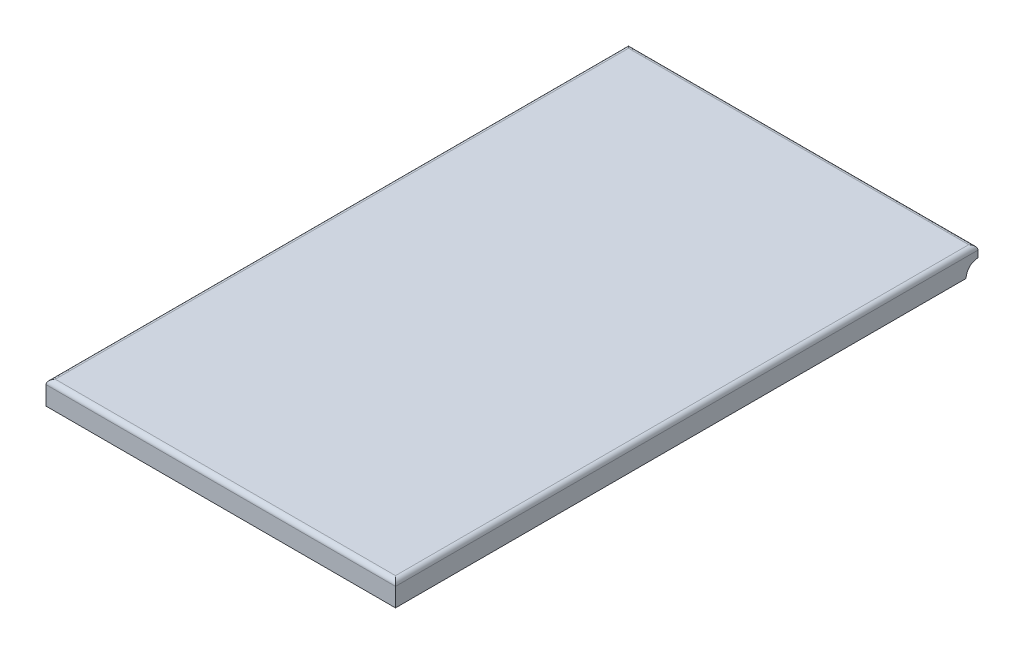
from build123d import *

# Parameters (mm, degrees)
SKETCH1_W           = 150
SKETCH1_H           = 10
BOSS_EXTRUDE1_DEPTH = 250
FILLET1_R           = 2
SKETCH2_R           = 5.1
CUT_EXTRUDE1_DEPTH  = 30.1
SKETCH3_R           = 5
BOSS_EXTRUDE2_DEPTH = 29.85
SKETCH4_R           = 5.1
CUT_EXTRUDE2_DEPTH  = 30.1
SKETCH5_R           = 5
BOSS_EXTRUDE3_DEPTH = 29.85
SKETCH6_R           = 5.1
CUT_EXTRUDE3_DEPTH  = 30.1
SKETCH7_R           = 0.875
CUT_EXTRUDE4_DEPTH  = 90.1


with BuildPart() as part:
    # Sketch1 → Boss-Extrude1 (new body)
    with BuildSketch(Plane.XY):
        with Locations((75, 5)):
            Rectangle(SKETCH1_W, SKETCH1_H)
    extrude(amount=BOSS_EXTRUDE1_DEPTH)

    # Fillet1
    fillet1_edges = [part.edges().sort_by_distance(p)[0] for p in [
        (75, 10, 250),
        (75, 10, 0),
        (0, 10, 125),
        (150, 10, 125),
    ]]
    fillet(fillet1_edges, radius=FILLET1_R)

    # Sketch2 → Cut-Extrude1 (cut)
    with BuildSketch(Plane(origin=(150, 0, 0), x_dir=(0, 0, -1), z_dir=(1, 0, 0))):
        Circle(SKETCH2_R)
    extrude(amount=-CUT_EXTRUDE1_DEPTH, mode=Mode.SUBTRACT)

    # Sketch3 → Boss-Extrude2 (add)
    with BuildSketch(Plane(origin=(119.9, 0, 0), x_dir=(0, 0, -1), z_dir=(1, 0, 0))):
        Circle(SKETCH3_R)
    extrude(amount=-BOSS_EXTRUDE2_DEPTH)

    # Sketch4 → Cut-Extrude2 (cut)
    with BuildSketch(Plane.ZY.offset(-90.05)):
        Circle(SKETCH4_R)
    extrude(amount=CUT_EXTRUDE2_DEPTH, mode=Mode.SUBTRACT)

    # Sketch5 → Boss-Extrude3 (add)
    with BuildSketch(Plane(origin=(59.95, 0, 0), x_dir=(0, 0, -1), z_dir=(1, 0, 0))):
        Circle(SKETCH5_R)
    extrude(amount=-BOSS_EXTRUDE3_DEPTH)

    # Sketch6 → Cut-Extrude3 (cut)
    with BuildSketch(Plane.ZY.offset(-30.1)):
        Circle(SKETCH6_R)
    extrude(amount=CUT_EXTRUDE3_DEPTH, mode=Mode.SUBTRACT)

    # Sketch7 → Cut-Extrude4 (cut)
    with BuildSketch(Plane(origin=(119.9, 0, 0), x_dir=(0, 0, -1), z_dir=(1, 0, 0))):
        Circle(SKETCH7_R)
    extrude(amount=-CUT_EXTRUDE4_DEPTH, mode=Mode.SUBTRACT)


solid = part.part
